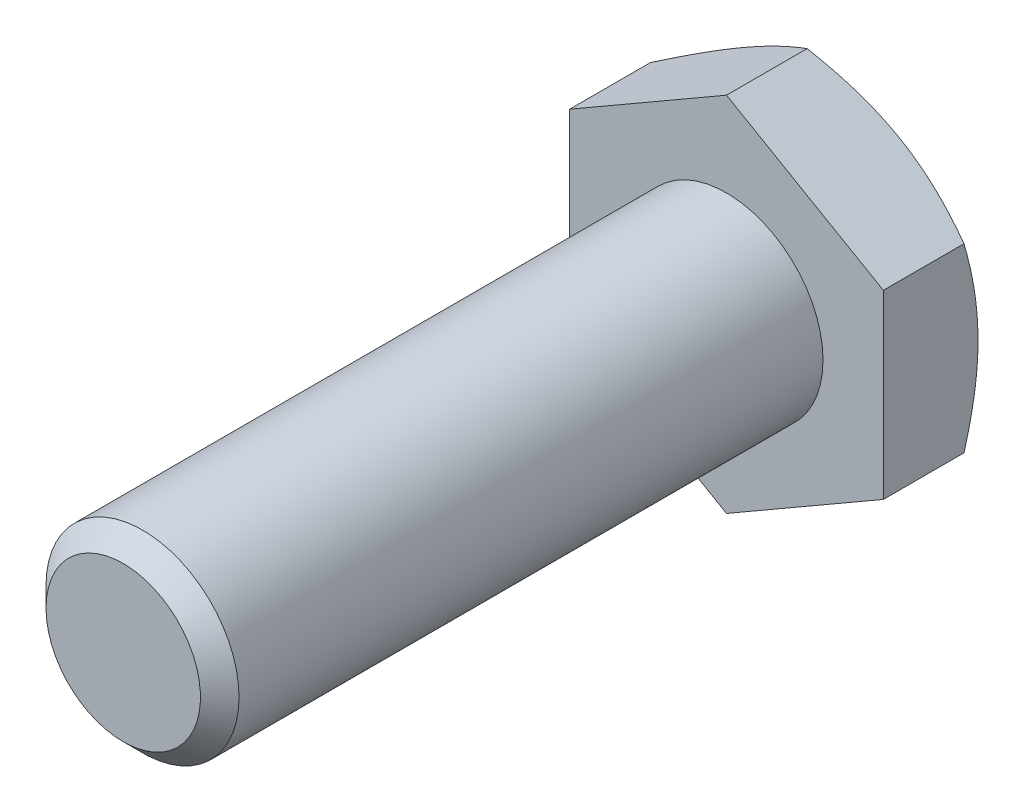
from build123d import *

# Parameters (mm, degrees)
ESQUISSE1_W        = 4
ESQUISSE1_H        = 25
CHANFREIN1_SIZE    = 0.8
BOSS_EXTRU_1_DEPTH = 4.5


with BuildPart() as part:
    # Esquisse1 → Base-Révolution (revolve)
    with BuildSketch(Plane(origin=(0, 0, 0), x_dir=(1, 0, 0), z_dir=(0, 1, 0))):
        with Locations((2, -12.5)):
            Rectangle(ESQUISSE1_W, ESQUISSE1_H)
    revolve(axis=Axis((0, 0, 0), (0, 0, 1)))

    # Chanfrein1
    chanfrein1_edges = [part.edges().sort_by_distance(p)[0] for p in [
        (-4, 0, 25),
    ]]
    chamfer(chanfrein1_edges, length=CHANFREIN1_SIZE)

    # Esquisse6 → Boss.-Extru.1 (add)
    with BuildSketch(Plane.XY):
        Polygon((6.5, -3.75277675), (6.5, 3.75277675), (0, 7.505553499), (-6.5, 3.75277675), (-6.5, -3.75277675), (0, -7.505553499), align=None)
    extrude(amount=-BOSS_EXTRU_1_DEPTH)

    # Esquisse7 → Enlèvement de matière-Révolution1 (revolve, cut)
    with BuildSketch(Plane(origin=(0, 0, 0), x_dir=(1, 0, 0), z_dir=(0, 1, 0))):
        Polygon((-5.5, 4.5), (-13.294228634, 4.5), (-13.294228634, 0), align=None)
    revolve(axis=Axis((0, 0, -6.239446496), (0, 0, 1)), mode=Mode.SUBTRACT)


solid = part.part
